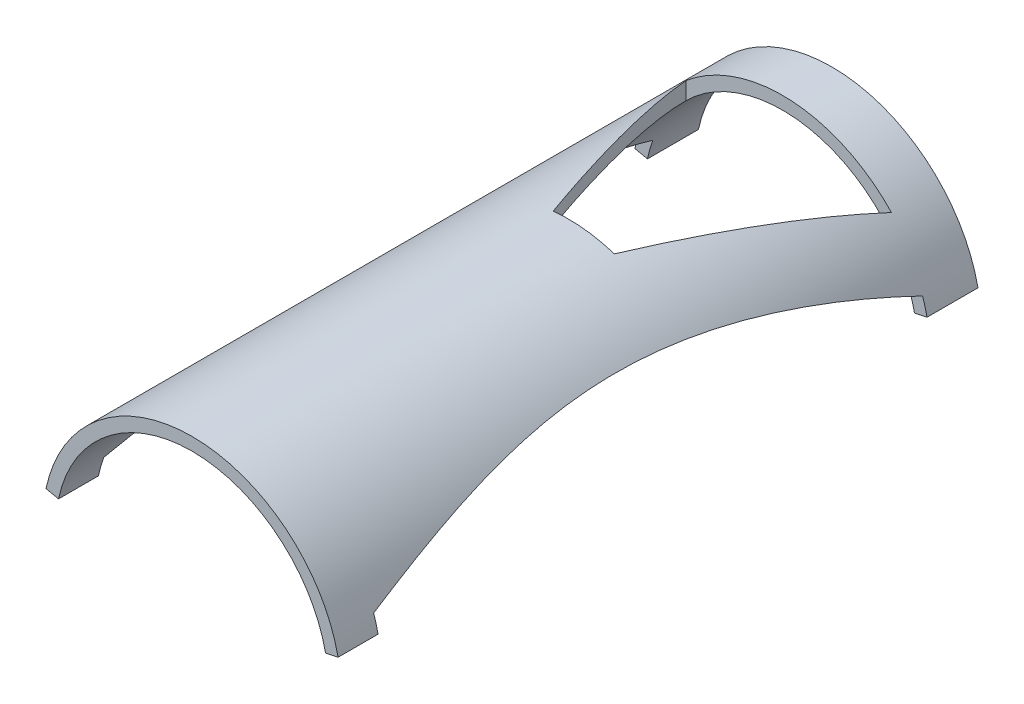
from build123d import *

# Parameters (mm, degrees)
SALIENTE_EXTRUIR1_DEPTH = 150
CORTAR_EXTRUIR1_DEPTH   = 158.787979874
CORTAR_EXTRUIR2_DEPTH   = 75


with BuildPart() as part:
    # Croquis1 → Saliente-Extruir1 (new body)
    with BuildSketch(Plane.XY):
        with BuildLine():
            Line((-34.235166026, 7.276909179), (-31.300723223, 6.653174106))
            ThreePointArc((-31.300723223, 6.653174106), (0, 32), (31.300723223, 6.653174106))
            Line((31.300723223, 6.653174106), (34.235166026, 7.276909179))
            ThreePointArc((34.235166026, 7.276909179), (0, 35), (-34.235166026, 7.276909179))
        make_face()
    extrude(amount=SALIENTE_EXTRUIR1_DEPTH)

    # Croquis2 → Cortar-Extruir1 (cut, through all)
    with BuildSketch(Plane(origin=(0, 0, 0), x_dir=(1, 0, 0), z_dir=(0, 1, 0))):
        Polygon((-22.708838208, -11.554693253), (25.4976429, -11.554693253), (10.756818098, -61.753177712), (-3.585606033, -61.753177712), align=None)
    extrude(amount=CORTAR_EXTRUIR1_DEPTH, mode=Mode.SUBTRACT)

    # Croquis3 → Cortar-Extruir2 (cut, symmetric)
    with BuildSketch(Plane(origin=(0, 0, 0), x_dir=(0, 0, -1), z_dir=(1, 0, 0))):
        with BuildLine():
            Line((-11.953093924, 11.065770631), (-11.953093924, 0))
            Line((-11.953093924, 0), (-140.636510433, 0))
            Line((-140.636510433, 0), (-140.636510433, 11.065770631))
            ThreePointArc((-140.636510433, 11.065770631), (-76.294802179, 23.859279702), (-11.953093924, 11.065770631))
        make_face()
    extrude(amount=CORTAR_EXTRUIR2_DEPTH, both=True, mode=Mode.SUBTRACT)


solid = part.part
